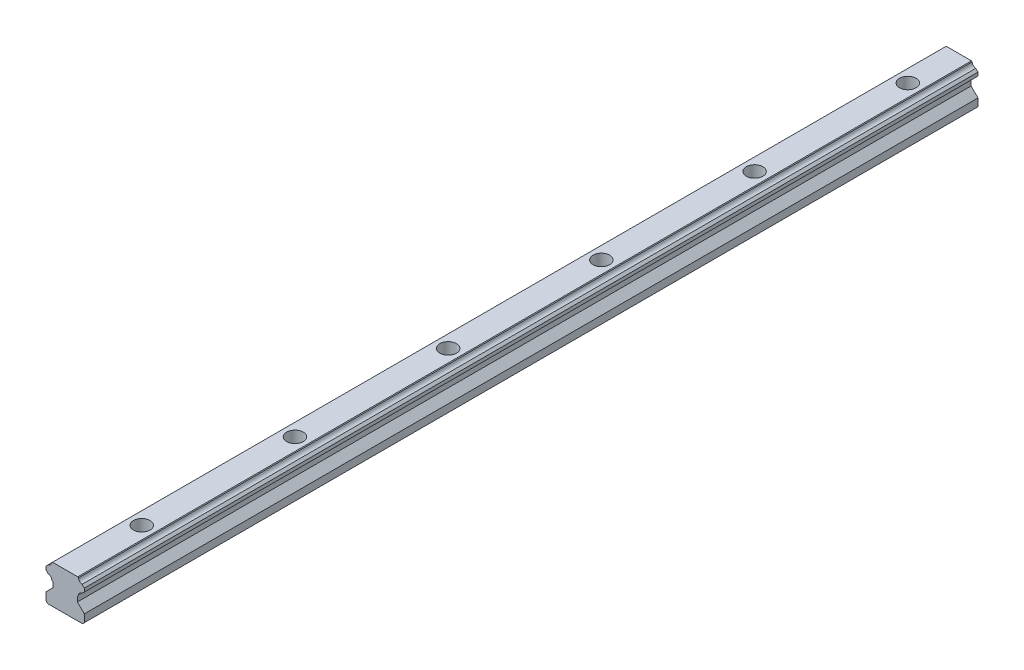
from build123d import *

# Parameters (mm, degrees)
EXTRUDE_1_DEPTH     = 600
SKETCH_2_R          = 3.25
CUT_EXTRUDE_1_DEPTH = 5.3
SKETCH_3_R          = 2.25
CUT_EXTRUDE_2_DEPTH = 601.125270256
SKETCH1_W           = 15
SKETCH1_H           = 250
CUT_EXTRUDE1_DEPTH  = 100


with BuildPart() as part:
    # Model → Бобышка-Вытянуть1 (new body)
    with BuildSketch(Plane.XY):
        with BuildLine():
            Line((6.8, 0), (7.5, 0.7))
            Line((7.5, 0.7), (7.5, 3.6994391))
            Line((7.5, 3.6994391), (4.7998047, 6.3996344))
            Line((4.7998047, 6.3996344), (4.7998047, 8.409149262))
            Line((4.7998047, 8.409149262), (5.20075838, 8.810103152))
            ThreePointArc((5.20075838, 8.810103152), (5.668922208, 9.789261508), (6.648080611, 10.257425237))
            Line((6.648080611, 10.257425237), (7.5, 11.109345046))
            Line((7.5, 11.109345046), (7.5, 12.449454443))
            Line((7.5, 12.449454443), (6.634490912, 13.314965186))
            ThreePointArc((6.634490912, 13.314965186), (5.668922174, 13.781617126), (5.202270193, 14.747185846))
            Line((5.202270193, 14.747185846), (4.949456226, 15))
            Line((4.949456226, 15), (-4.949456226, 15))
            Line((-4.949456226, 15), (-5.202270193, 14.747185846))
            ThreePointArc((-5.202270193, 14.747185846), (-5.668922174, 13.781617126), (-6.634490912, 13.314965186))
            Line((-6.634490912, 13.314965186), (-7.5, 12.449454443))
            Line((-7.5, 12.449454443), (-7.5, 11.109345046))
            Line((-7.5, 11.109345046), (-6.648080611, 10.257425238))
            ThreePointArc((-6.648080611, 10.257425238), (-5.668922208, 9.789261508), (-5.20075838, 8.810103152))
            Line((-5.20075838, 8.810103152), (-4.7998047, 8.409149262))
            Line((-4.7998047, 8.409149262), (-4.7998047, 6.3996344))
            Line((-4.7998047, 6.3996344), (-7.5, 3.6994391))
            Line((-7.5, 3.6994391), (-7.5, 0.7))
            Line((-7.5, 0.7), (-6.8, 0))
            Line((-6.8, 0), (6.8, 0))
        make_face()
    extrude(amount=EXTRUDE_1_DEPTH)

    # Эскиз2 → Вырез-Вытянуть1 (cut)
    with BuildSketch(Plane(origin=(0, 15, 0), x_dir=(1, 0, 0), z_dir=(0, 1, 0))):
        with Locations(Location((0, -30, 0), (0, 0, 180))):
            Circle(SKETCH_2_R)
        with Locations(Location((0, -90, 0), (0, 0, 180))):
            Circle(SKETCH_2_R)
        with Locations(Location((0, -150, 0), (0, 0, 180))):
            Circle(SKETCH_2_R)
        with Locations(Location((0, -210, 0), (0, 0, 180))):
            Circle(SKETCH_2_R)
        with Locations(Location((0, -270, 0), (0, 0, 180))):
            Circle(SKETCH_2_R)
        with Locations(Location((0, -330, 0), (0, 0, 180))):
            Circle(SKETCH_2_R)
        with Locations(Location((0, -390, 0), (0, 0, 180))):
            Circle(SKETCH_2_R)
        with Locations(Location((0, -450, 0), (0, 0, 180))):
            Circle(SKETCH_2_R)
        with Locations(Location((0, -510, 0), (0, 0, 180))):
            Circle(SKETCH_2_R)
        with Locations(Location((0, -570, 0), (0, 0, 180))):
            Circle(SKETCH_2_R)
    extrude(amount=-CUT_EXTRUDE_1_DEPTH, mode=Mode.SUBTRACT)

    # Эскиз3 → Вырез-Вытянуть2 (cut, through all)
    with BuildSketch(Plane(origin=(0, 9.7, 0), x_dir=(1, 0, 0), z_dir=(0, 1, 0))):
        with Locations(Location((0, -30, 0), (0, 0, 180))):
            Circle(SKETCH_3_R)
        with Locations(Location((0, -90, 0), (0, 0, 180))):
            Circle(SKETCH_3_R)
        with Locations(Location((0, -150, 0), (0, 0, 180))):
            Circle(SKETCH_3_R)
        with Locations(Location((0, -210, 0), (0, 0, 180))):
            Circle(SKETCH_3_R)
        with Locations(Location((0, -270, 0), (0, 0, 180))):
            Circle(SKETCH_3_R)
        with Locations(Location((0, -330, 0), (0, 0, 180))):
            Circle(SKETCH_3_R)
        with Locations(Location((0, -390, 0), (0, 0, 180))):
            Circle(SKETCH_3_R)
        with Locations(Location((0, -450, 0), (0, 0, 180))):
            Circle(SKETCH_3_R)
        with Locations(Location((0, -510, 0), (0, 0, 180))):
            Circle(SKETCH_3_R)
        with Locations(Location((0, -570, 0), (0, 0, 180))):
            Circle(SKETCH_3_R)
    extrude(amount=-CUT_EXTRUDE_2_DEPTH, mode=Mode.SUBTRACT)

    # Sketch1 → Cut-Extrude1 (cut)
    with BuildSketch(Plane(origin=(0, 15, 0), x_dir=(1, 0, 0), z_dir=(0, 1, 0))):
        with Locations((0, -125)):
            Rectangle(SKETCH1_W, SKETCH1_H)
    extrude(amount=-CUT_EXTRUDE1_DEPTH, mode=Mode.SUBTRACT)


solid = part.part
